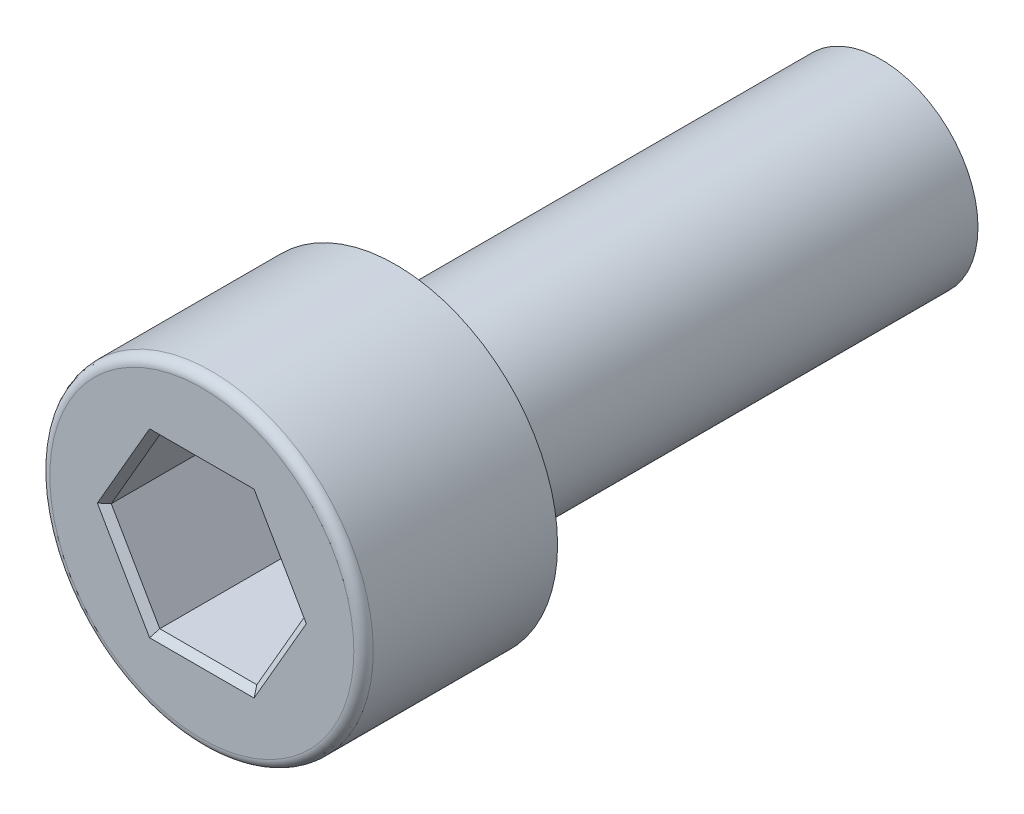
from build123d import *

# Parameters (mm, degrees)
ESQUISSE1_R             = 3
BASE_EXTRUSION_DEPTH    = 15
ESQUISSE2_R             = 5
BOSS_EXTRU_1_DEPTH      = 6
ENL_V_MAT_EXTRU_1_DEPTH = 4
CHANFREIN3_SIZE         = 0.2
CONG_1_R                = 0.3


with BuildPart() as part:
    # Esquisse1 → Base-Extrusion (new body)
    with BuildSketch(Plane.XY):
        Circle(ESQUISSE1_R)
    extrude(amount=BASE_EXTRUSION_DEPTH)

    # Esquisse2 → Boss.-Extru.1 (add)
    with BuildSketch(Plane.XY.offset(15)):
        Circle(ESQUISSE2_R)
    extrude(amount=BOSS_EXTRU_1_DEPTH)

    # Esquisse3 → Enlèv. mat.-Extru.1 (cut)
    with BuildSketch(Plane.XY.offset(21)):
        Polygon((-3, 0), (-1.500108314, 2.598013673), (1.500108314, 2.598013673), (3, 0), (1.500108314, -2.598013673), (-1.500108314, -2.598013673), align=None)
    extrude(amount=-ENL_V_MAT_EXTRU_1_DEPTH, mode=Mode.SUBTRACT)

    # Chanfrein3
    chanfrein3_edges = [part.edges().sort_by_distance(p)[0] for p in [
        (-2.250054157, -1.299006837, 21),
        (0, -2.598013673, 21),
        (2.250054157, -1.299006837, 21),
        (2.250054157, 1.299006837, 21),
        (0, 2.598013673, 21),
        (-2.250054157, 1.299006837, 21),
    ]]
    chamfer(chanfrein3_edges, length=CHANFREIN3_SIZE)

    # Congé1
    cong_1_edges = [part.edges().sort_by_distance(p)[0] for p in [
        (-5, 0, 21),
    ]]
    fillet(cong_1_edges, radius=CONG_1_R)


solid = part.part
